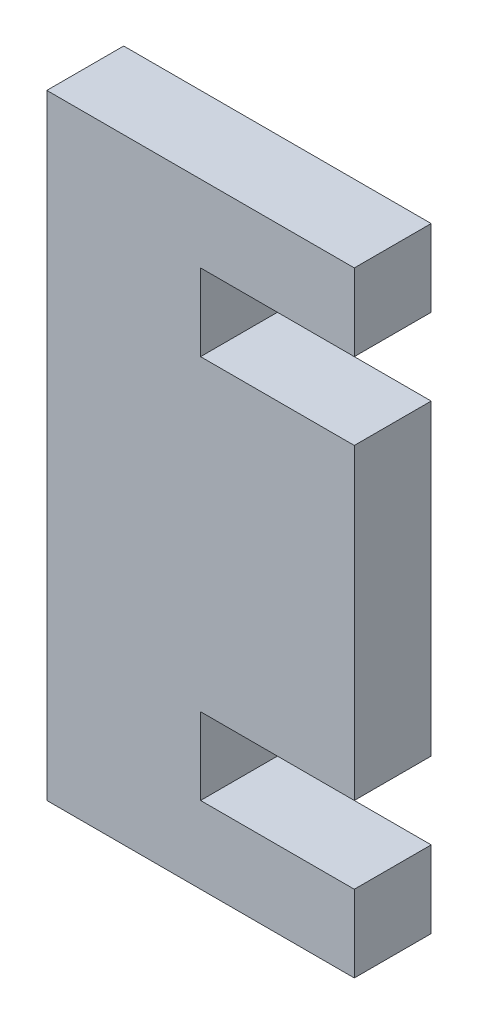
from build123d import *

# Parameters (mm, degrees)
BOSS_EXTRUDE1_DEPTH = 5


with BuildPart() as part:
    # Sketch1 → Boss-Extrude1 (new body)
    with BuildSketch(Plane.XY):
        Polygon((20, -10), (20, -30), (10, -30), (10, -35), (20, -35), (20, -40), (0, -40), (0, 0), (20, 0), (20, -5), (10, -5), (10, -10), align=None)
    extrude(amount=BOSS_EXTRUDE1_DEPTH)


solid = part.part
